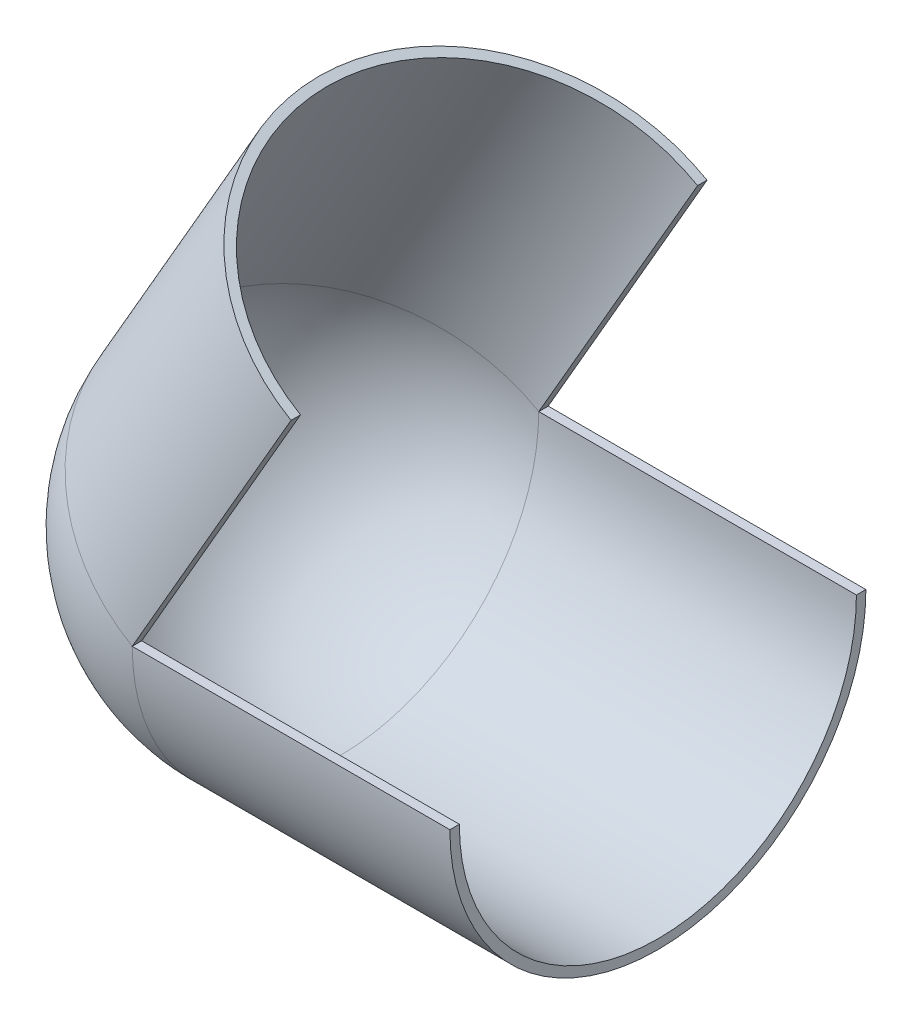
from build123d import *

# Parameters (mm, degrees)
REVOLVE4_ANGLE      = 120
BOSS_EXTRUDE3_DEPTH = 203.2
BOSS_EXTRUDE4_DEPTH = 203.2


with BuildPart() as part:
    # Sketch7 → Revolve4 (revolve)
    with BuildSketch(Plane(origin=(0, 0, 0), x_dir=(0, 0, -1), z_dir=(1, 0, 0))):
        with BuildLine():
            Line((-133.054110977, 0), (-127, 0))
            ThreePointArc((-127, 0), (0, -127), (127, 0))
            Line((127, 0), (133.054110977, 0))
            ThreePointArc((133.054110977, 0), (0, -133.054110977), (-133.054110977, 0))
        make_face()
    revolve(axis=Axis((0, 0, 127), (0, 0, -1)), revolution_arc=REVOLVE4_ANGLE)

    # Sketch8 → Boss-Extrude3 (add)
    with BuildSketch(Plane(origin=(0, 0, 0), x_dir=(0, 0, -1), z_dir=(1, 0, 0))):
        with BuildLine():
            Line((-127, 0), (-133.054110977, 0))
            ThreePointArc((-133.054110977, 0), (0, -133.054110977), (133.054110977, 0))
            Line((133.054110977, 0), (127, 0))
            ThreePointArc((127, 0), (0, -127), (-127, 0))
        make_face()
    extrude(amount=BOSS_EXTRUDE3_DEPTH)

    # Sketch9 → Boss-Extrude4 (add)
    with BuildSketch(Plane(origin=(0, 0, 0), x_dir=(0.8660254037844363, -0.5000000000000043, 0), z_dir=(0.5000000000000042, 0.8660254037844362, 0))):
        with BuildLine():
            Line((0, 127), (0, 133.054110977))
            ThreePointArc((0, 133.054110977), (-133.054110977, 0), (0, -133.054110977))
            Line((0, -133.054110977), (0, -127))
            ThreePointArc((0, -127), (-127, 0), (0, 127))
        make_face()
    extrude(amount=BOSS_EXTRUDE4_DEPTH)


solid = part.part
